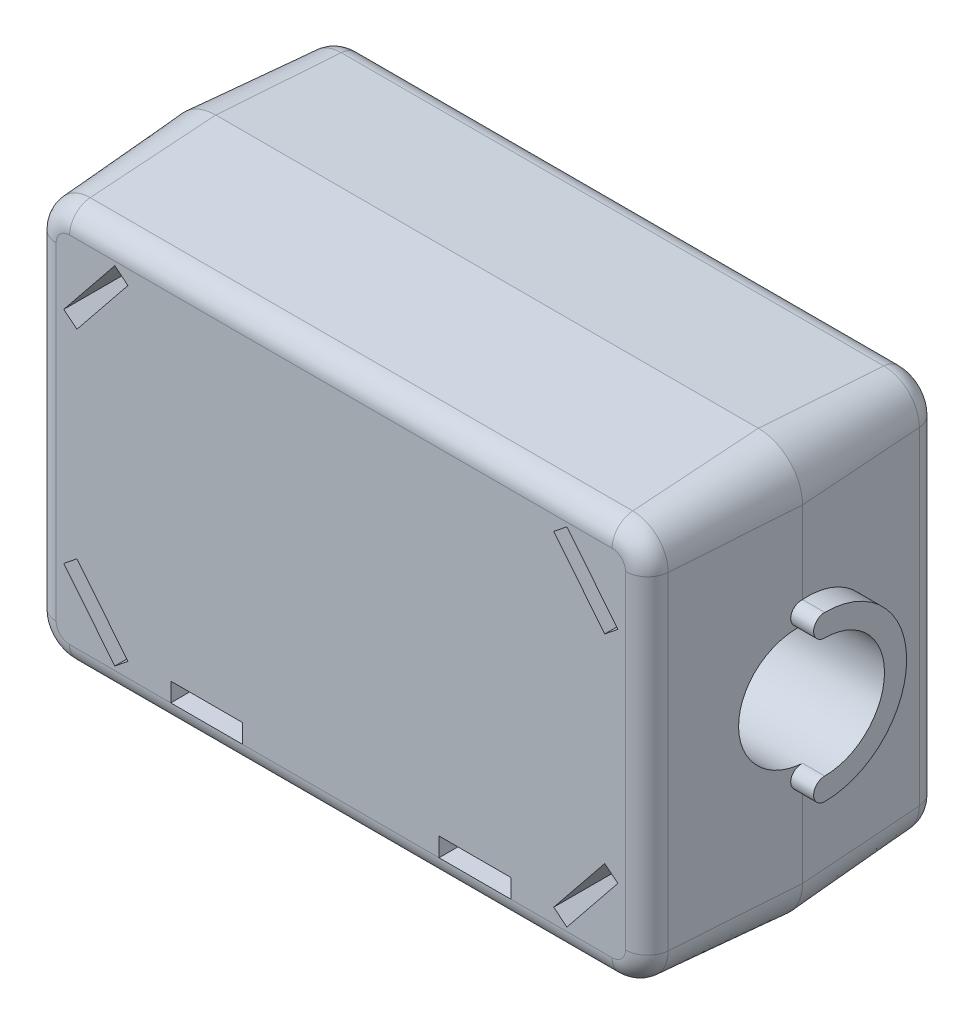
from build123d import *

# Parameters (mm, degrees)
EXTRUSION1_DEPTH           = 6.6
EXTRUSION1_TAPER           = 4.000000000000009
EXTRUSION1_OTHER_WAY_DEPTH = 6.6
EXTRUSION1_OTHER_WAY_TAPER = 4.000000000000009
CONG_1_R                   = 1
ESQUISSE2_R                = 2.7
ENL_V_MAT_EXTRU_1_DEPTH    = 35.77427225377981
EXTRUSION2_START           = -11
EXTRUSION2_DEPTH           = 11
EXTRUSION3_DEPTH           = 19.5
ESQUISSE5_W                = 3.2474365518074073
ESQUISSE5_H                = 0.8522228738252646
ESQUISSE5_W_2              = 3.247436551807409
EXTRUSION4_DEPTH           = 5


with BuildPart() as part:
    # Esquisse1 → Extrusion1 (new body)
    with BuildSketch(Plane.XY):
        with BuildLine():
            Line((2.000000000000013, 0), (26.500000000000004, 0))
            ThreePointArc((26.500000000000004, 0), (27.9142135623731, 0.5857864376269051), (28.500000000000004, 2.0000000000000004))
            Line((28.500000000000004, 2.0000000000000004), (28.499999999999996, 16.8))
            ThreePointArc((28.499999999999996, 16.8), (27.914213562373096, 18.2142135623731), (26.499999999999996, 18.800000000000004))
            Line((26.499999999999996, 18.800000000000004), (2, 18.800000000000004))
            ThreePointArc((2, 18.800000000000004), (0.5857864376269051, 18.214213562373097), (0, 16.8))
            Line((0, 16.8), (-6.3e-16, 2.000000000000013))
            ThreePointArc((-6.3e-16, 2.000000000000013), (0.5857864376269053, 0.5857864376269042), (2.000000000000013, 0))
        make_face()
    extrude(amount=EXTRUSION1_DEPTH, taper=EXTRUSION1_TAPER)

    # Esquisse1 → Extrusion1 other way (add)
    with BuildSketch(Plane.XY):
        with BuildLine():
            Line((2.000000000000013, 0), (26.500000000000004, 0))
            ThreePointArc((26.500000000000004, 0), (27.9142135623731, 0.5857864376269051), (28.500000000000004, 2.0000000000000004))
            Line((28.500000000000004, 2.0000000000000004), (28.499999999999996, 16.8))
            ThreePointArc((28.499999999999996, 16.8), (27.914213562373096, 18.2142135623731), (26.499999999999996, 18.800000000000004))
            Line((26.499999999999996, 18.800000000000004), (2, 18.800000000000004))
            ThreePointArc((2, 18.800000000000004), (0.5857864376269051, 18.214213562373097), (0, 16.8))
            Line((0, 16.8), (-6.3e-16, 2.000000000000013))
            ThreePointArc((-6.3e-16, 2.000000000000013), (0.5857864376269053, 0.5857864376269042), (2.000000000000013, 0))
        make_face()
    extrude(amount=-EXTRUSION1_OTHER_WAY_DEPTH, taper=EXTRUSION1_OTHER_WAY_TAPER)

    # Congé1
    cong_1_edges = [part.edges().sort_by_distance(p)[0] for p in [
        (0.9121282088461893, 0.9121282088461893, 6.6),
        (14.250000000000007, 0.46151695882717014, 6.6000000000000005),
        (27.587871791153816, 0.9121282088461893, 6.6),
        (28.03848304117283, 9.4, 6.6000000000000005),
        (27.587871791153812, 17.887871791153817, 6.6),
        (14.25, 18.338483041172836, 6.6000000000000005),
        (0.9121282088461911, 17.887871791153813, -6.6),
        (14.250000000000005, 18.338483041172836, -6.6),
        (27.587871791153812, 17.887871791153813, -6.6),
        (28.03848304117283, 9.400000000000006, -6.6),
        (27.587871791153816, 0.9121282088461875, -6.6),
        (14.250000000000004, 0.46151695882717014, -6.6),
        (0.9121282088461893, 0.9121282088461893, -6.6),
        (0.46151695882717014, 9.4, -6.6),
        (0.9121282088461893, 17.887871791153813, 6.6),
        (0.46151695882717014, 9.400000000000006, 6.6000000000000005),
    ]]
    fillet(cong_1_edges, radius=CONG_1_R)

    # Esquisse2 → Enlèv. mat.-Extru.1 (cut, through all)
    with BuildSketch(Plane(origin=(0, 0, 0), x_dir=(0, 0, -1), z_dir=(1, 0, 0))):
        with Locations(Location((0, 9.40000000000001, 0), (0, 0, 90))):
            Circle(ESQUISSE2_R)
    extrude(amount=ENL_V_MAT_EXTRU_1_DEPTH, mode=Mode.SUBTRACT)

    # Esquisse3 → Extrusion2 (add)
    with BuildSketch(Plane(origin=(10, 0, 0), x_dir=(0, 0, -1), z_dir=(1, 0, 0)).offset(EXTRUSION2_START)):
        with BuildLine():
            ThreePointArc((0, 12.100000000000007), (-2.6999999999999975, 9.400000000000007), (6.16e-15, 6.700000000000009))
            ThreePointArc((6.16e-15, 6.700000000000009), (0.5000000000000038, 6.200000000000009), (5.89e-15, 5.700000000000011))
            ThreePointArc((5.89e-15, 5.700000000000011), (-3.6999999999999975, 9.400000000000006), (2.3e-16, 13.100000000000007))
            ThreePointArc((2.3e-16, 13.100000000000007), (0.4999999999999991, 12.600000000000007), (0, 12.100000000000007))
        make_face()
    extrude(amount=EXTRUSION2_DEPTH)

    # Esquisse4 → Extrusion3 (add)
    with BuildSketch(Plane(origin=(10, 0, 0), x_dir=(0, 0, -1), z_dir=(1, 0, 0))):
        with BuildLine():
            ThreePointArc((0, 6.700000000000006), (2.700000000000003, 9.400000000000043), (-6.772e-14, 12.10000000000001))
            ThreePointArc((-6.772e-14, 12.10000000000001), (-0.5000000000000799, 12.6), (-9.088e-14, 13.10000000000001))
            ThreePointArc((-9.088e-14, 13.10000000000001), (3.700000000000002, 9.400000000000054), (-6.8e-16, 5.700000000000007))
            ThreePointArc((-6.8e-16, 5.700000000000007), (-0.5000000000000002, 6.200000000000007), (0, 6.700000000000006))
        make_face()
    extrude(amount=EXTRUSION3_DEPTH)

    # Esquisse5 → Extrusion4 (cut)
    with BuildSketch(Plane.XY.offset(6.6)):
        with Locations((20.306831390499674, 1.820143481877461)):
            Rectangle(ESQUISSE5_W, ESQUISSE5_H)
        with Locations((8.193168609500333, 1.820143481877461)):
            Rectangle(ESQUISSE5_W_2, ESQUISSE5_H)
        Polygon((1.7379562995508964, 14.367502834636706), (4.041510066838186, 17.227086821613987), (4.636308888649757, 16.74794332626577), (2.3327551213624673, 13.888359339288488), align=None)
        Polygon((2.3327551213624673, 4.911640660711529), (4.636308888649757, 2.052056673734249), (4.041510066838186, 1.5729131783860304), (1.7379562995508964, 4.432497165363312), align=None)
        Polygon((26.762043700449112, 4.43249716536331), (24.45848993316182, 1.5729131783860304), (23.863691111350253, 2.0520566737342487), (26.16724487863754, 4.9116406607115275), align=None)
        Polygon((26.16724487863754, 13.888359339288483), (23.863691111350253, 16.747943326265762), (24.45848993316182, 17.227086821613973), (26.762043700449112, 14.3675028346367), align=None)
    extrude(amount=-EXTRUSION4_DEPTH, mode=Mode.SUBTRACT)


solid = part.part
